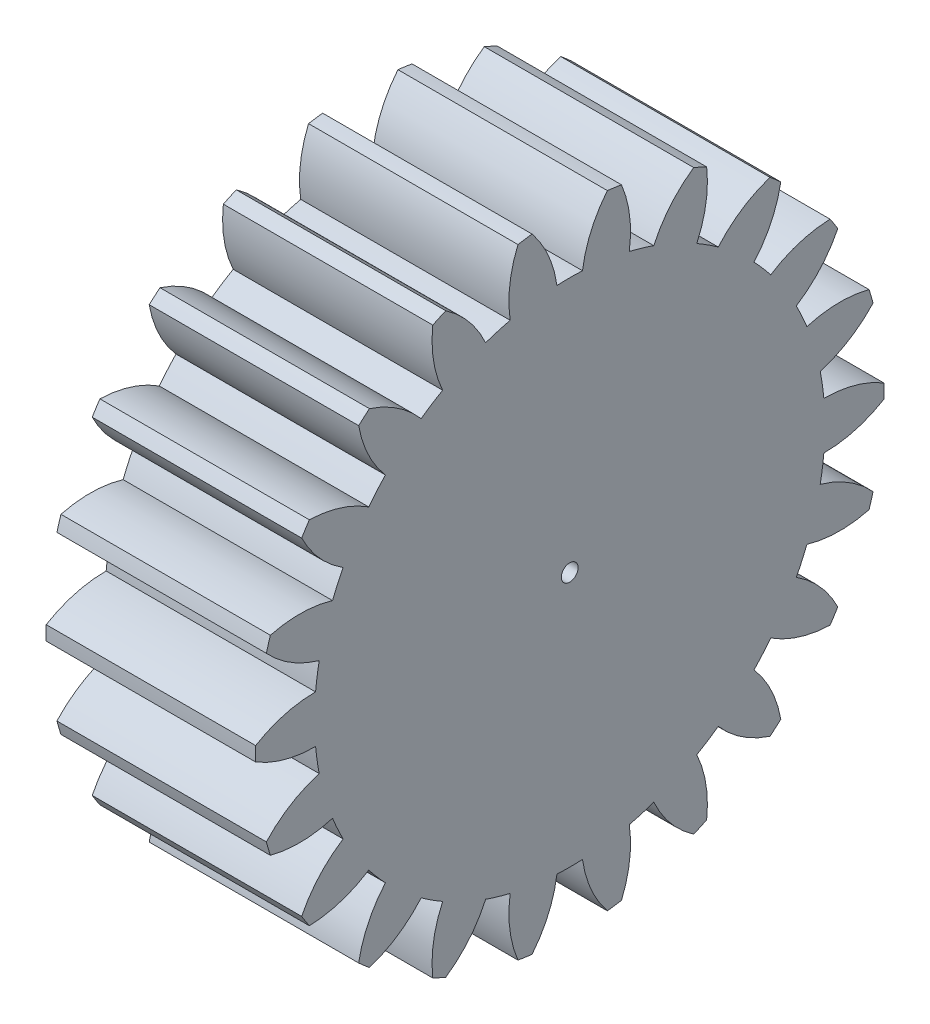
from build123d import *

# Parameters (mm, degrees)
BASPROSKE_W     = 10
BASPROSKE_H     = 15
TOOTHCUT_DEPTH  = 24.452078799
TEETHCUTS_COUNT = 22
TEETHCUTS_ANGLE = 343.636363636
BORSKE_R        = 0.4
BORE_DEPTH      = 50.0000508


with BuildPart() as part:
    # BasProSke → Base-Revolve (revolve)
    with BuildSketch(Plane(origin=(0, 0, 0), x_dir=(1, 0, 0), z_dir=(0, 1, 0)), mode=Mode.PRIVATE) as base_revolve_sk:
        with Locations((5, 7.5)):
            Rectangle(BASPROSKE_W, BASPROSKE_H)
    revolve(base_revolve_sk.sketch.rotate(Axis((-10, 0, 0), (1, 0, 0)), 180), axis=Axis((-10, 0, 0), (1, 0, 0)))

    # TooCutSke → ToothCut (cut, through all)
    with BuildSketch(Plane(origin=(0, 0, 0), x_dir=(0, 0, -1), z_dir=(1, 0, 0))):
        with BuildLine():
            ThreePointArc((0.609906099, 12.171228237), (0, 12.1865), (-0.609906099, 12.171228237))
            ThreePointArc((-0.609906099, 12.171228237), (-1.022716454, 13.626997902), (-1.81660957, 14.915179343))
            ThreePointArc((-1.81660957, 14.915179343), (0, 15.0254), (1.81660957, 14.915179343))
            ThreePointArc((1.81660957, 14.915179343), (1.022716454, 13.626997902), (0.609906099, 12.171228237))
        make_face()
    toothcut = extrude(amount=TOOTHCUT_DEPTH, mode=Mode.SUBTRACT)

    # TeethCuts: ToothCut ×22 about axis
    teethcuts_axis = Axis((-10, 0, 0), (1, 0, 0))
    for i in range(1, TEETHCUTS_COUNT):
        add(toothcut.rotate(teethcuts_axis, i * TEETHCUTS_ANGLE / (TEETHCUTS_COUNT - 1)), mode=Mode.SUBTRACT)

    # BorSke → Bore (cut, symmetric)
    with BuildSketch(Plane(origin=(0, 0, 0), x_dir=(0, 0, -1), z_dir=(1, 0, 0))):
        with Locations(Location((0, 0, 0), (0, 0, 180))):
            Circle(BORSKE_R)
    extrude(amount=BORE_DEPTH, both=True, mode=Mode.SUBTRACT)


solid = part.part
